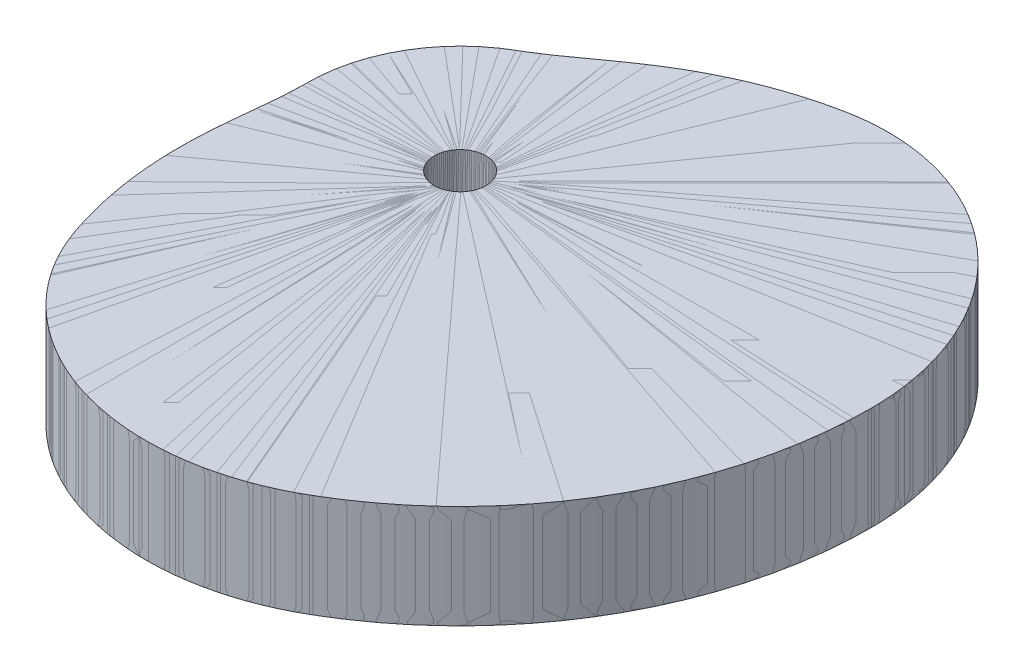
from build123d import *

# Parameters (mm, degrees)
SKETCH_1_W           = 75
SKETCH_1_H           = 20
EXTRUDE_1_DEPTH      = 10
EXTRUDE_1_DEPTH_BACK = 30
SKETCH_2_OUTSIDE_W   = 207.432
SKETCH_2_OUTSIDE_H   = 207.432
SKETCH_3_R           = 5
EXTRUDE_1_2_DEPTH    = 20


with BuildPart() as part:
    # 草图1 → 旋转1 (revolve)
    with BuildSketch(Plane.XY, mode=Mode.PRIVATE) as revolve_1_sk:
        with Locations((42.5, -10)):
            Rectangle(SKETCH_1_W, SKETCH_1_H)
    revolve(revolve_1_sk.sketch.rotate(Axis((0, -20200, 0), (0, 1, 0)), 90), axis=Axis((0, -20200, 0), (0, 1, 0)))

    # 草图2 outside → 凸台-拉伸1 (cut, two sides: drawn at the far end of the back side and taken through both)
    with BuildSketch(Plane(origin=(0, 0, 0), x_dir=(1, 0, 0), z_dir=(0, 1, 0)).offset(-EXTRUDE_1_DEPTH_BACK)):
        Rectangle(SKETCH_2_OUTSIDE_W, SKETCH_2_OUTSIDE_H)
        with BuildLine():
            ThreePointArc((79.5, 0), (79.381433397, 3.452577159), (79.027024278, 6.888962069))
            ThreePointArc((79.027024278, 6.888962069), (78.439064803, 10.286491194), (77.619168459, 13.635621004))
            ThreePointArc((77.619168459, 13.635621004), (76.57463167, 16.907988409), (75.306541664, 20.100384573))
            ThreePointArc((75.306541664, 20.100384573), (73.828400163, 23.179959664), (72.139248239, 26.149042151))
            ThreePointArc((72.139248239, 26.149042151), (70.25992434, 28.971960449), (68.186251683, 31.655355267))
            ThreePointArc((68.186251683, 31.655355267), (65.947043042, 34.162742462), (63.534209397, 36.503528587))
            ThreePointArc((63.534209397, 36.503528587), (60.984563281, 38.64264015), (58.285999266, 40.590522553))
            ThreePointArc((58.285999266, 40.590522553), (55.482647347, 42.315779013), (52.558956845, 43.828169731))
            ThreePointArc((52.558956845, 43.828169731), (49.564925997, 45.102068829), (46.48284657, 46.14505782))
            ThreePointArc((46.48284657, 46.14505782), (43.3663652, 46.93894686), (40.197595882, 47.488143497))
            ThreePointArc((40.197595882, 47.488143497), (37.030919611, 47.782838856), (33.850827709, 47.824063296))
            ThreePointArc((33.850827709, 47.824063296), (30.706387283, 47.610022696), (27.590017439, 47.139323254))
            ThreePointArc((27.590017439, 47.139323254), (24.626341718, 46.502961294), (21.691062658, 45.746345697))
            ThreePointArc((21.691062658, 45.746345697), (19.013886194, 44.941804489), (16.369597688, 44.034997636))
            ThreePointArc((16.369597688, 44.034997636), (13.971770793, 43.112041989), (11.608221997, 42.104541099))
            ThreePointArc((11.608221997, 42.104541099), (9.473436051, 41.107963918), (7.371482623, 40.04388267))
            ThreePointArc((7.371482623, 40.04388267), (5.477547324, 39.013184654), (3.612489578, 37.931108445))
            ThreePointArc((3.612489578, 37.931108445), (1.932202619, 36.899828273), (0.274753752, 35.832229889))
            ThreePointArc((0.274753752, 35.832229889), (-1.223174909, 34.82743326), (-2.705838514, 33.800245268))
            ThreePointArc((-2.705838514, 33.800245268), (-4.055816388, 32.842213366), (-5.398920019, 31.87456776))
            ThreePointArc((-5.398920019, 31.87456776), (-6.637441029, 30.976734903), (-7.877381278, 30.080863085))
            ThreePointArc((-7.877381278, 30.080863085), (-9.041881196, 29.250028327), (-10.214904591, 28.431271605))
            ThreePointArc((-10.214904591, 28.431271605), (-11.342435106, 27.668001539), (-12.483310422, 26.924826076))
            ThreePointArc((-12.483310422, 26.924826076), (-13.60906373, 26.223792048), (-14.75, 25.547749412))
            ThreePointArc((-14.75, 25.547749412), (-25.547749412, 14.75), (-29.5, 0))
            ThreePointArc((-29.5, 0), (-29.515001962, -1.326101112), (-29.559238586, -2.651549089))
            ThreePointArc((-29.559238586, -2.651549089), (-29.632409757, -4.011163827), (-29.729655768, -5.36926893))
            ThreePointArc((-29.729655768, -5.36926893), (-29.85220819, -6.79451535), (-29.989482238, -8.218419241))
            ThreePointArc((-29.989482238, -8.218419241), (-30.145359867, -9.740174904), (-30.303645424, -11.261681991))
            ThreePointArc((-30.303645424, -11.261681991), (-30.470099286, -12.908666658), (-30.624790313, -14.556797742))
            ThreePointArc((-30.624790313, -14.556797742), (-30.773029406, -16.354416086), (-30.894244483, -18.154058674))
            ThreePointArc((-30.894244483, -18.154058674), (-30.99008737, -20.12325069), (-31.043058718, -22.094061968))
            ThreePointArc((-31.043058718, -22.094061968), (-31.04763533, -24.25028746), (-30.993278347, -26.40583255))
            ThreePointArc((-30.993278347, -26.40583255), (-30.863823025, -28.75821824), (-30.659491208, -31.105285692))
            ThreePointArc((-30.659491208, -31.105285692), (-30.350238175, -33.655929437), (-29.950627764, -36.193986266))
            ThreePointArc((-29.950627764, -36.193986266), (-29.413801282, -38.937410714), (-28.771966175, -41.658184145))
            ThreePointArc((-28.771966175, -41.658184145), (-27.959574973, -44.578518177), (-27.028842736, -47.46331762))
            ThreePointArc((-27.028842736, -47.46331762), (-25.878295488, -50.397522794), (-24.491439872, -53.227708384))
            ThreePointArc((-24.491439872, -53.227708384), (-22.865692509, -55.961136537), (-21.027140706, -58.556210953))
            ThreePointArc((-21.027140706, -58.556210953), (-18.967137808, -61.025847363), (-16.721369046, -63.32785488))
            ThreePointArc((-16.721369046, -63.32785488), (-14.27707437, -65.475519464), (-11.676829966, -67.43147669))
            ThreePointArc((-11.676829966, -67.43147669), (-8.905215933, -69.207271578), (-6.009424051, -70.772417326))
            ThreePointArc((-6.009424051, -70.772417326), (-2.973226399, -72.135501115), (0.154121614, -73.274003641))
            ThreePointArc((0.154121614, -73.274003641), (3.387718686, -74.19318581), (6.678784014, -74.87870378))
            ThreePointArc((6.678784014, -74.87870378), (10.039508423, -75.332859571), (13.423889332, -75.54894266))
            ThreePointArc((13.423889332, -75.54894266), (16.839766154, -75.527249894), (20.245827165, -75.267570439))
            ThreePointArc((20.245827165, -75.267570439), (23.644568346, -74.769570516), (27.000790044, -74.037982208))
            ThreePointArc((27.000790044, -74.037982208), (30.311169712, -73.073468366), (33.547495981, -71.883891645))
            ThreePointArc((33.547495981, -71.883891645), (36.700697171, -70.47262649), (39.75, -68.849019601))
            ThreePointArc((39.75, -68.849019601), (68.849019601, -39.75), (79.5, 0))
        make_face(mode=Mode.SUBTRACT)
    extrude(amount=EXTRUDE_1_DEPTH + EXTRUDE_1_DEPTH_BACK, mode=Mode.SUBTRACT)


with BuildPart() as body_2:
    # 草图3 → Extrude 1 2 (new body)
    with BuildSketch(Plane(origin=(0, 0, 0), x_dir=(1, 0, 0), z_dir=(0, 1, 0))):
        with BuildLine():
            add(Edge.make_bspline(
                [(15.132016876, -75.567878359), (16.271104151, -75.560644505), (17.409246721, -75.513701582), (18.545060733, -75.427106667), (18.702680601, -75.415089665), (19.017804008, -75.389529847), (19.4901499, -75.346652724), (19.804715787, -75.314961987), (19.96191955, -75.298366566), (20.18327796, -75.274998575), (20.625680791, -75.225288273), (21.288357725, -75.141795255), (21.729264917, -75.080214194), (21.949501711, -75.047944039), (23.082866791, -74.88187793), (24.209815662, -74.676742374), (25.329001934, -74.43278245), (25.468716954, -74.402327407), (25.747884104, -74.340211299), (26.165856973, -74.243446536), (26.443904546, -74.176497103), (26.582782703, -74.142428734), (26.815337404, -74.085380459), (27.279630106, -73.967954673), (27.973635973, -73.78182007), (28.434376258, -73.651149037), (28.664266952, -73.584167972), (29.768161336, -73.262536763), (30.860353458, -72.903168134), (31.939553655, -72.506486426), (32.299488776, -72.374185043), (33.016325742, -72.101330034), (34.082536238, -71.667235598), (34.786149824, -71.361896313), (35.136171648, -71.2052385), (36.187649136, -70.734633089), (37.222409319, -70.228327129), (38.239240497, -69.686913502), (38.408671012, -69.596699913), (38.746503011, -69.41434011), (39.25060145, -69.13574201), (39.583765547, -68.944995107), (39.75, -68.849019601), (39.916706835, -68.752771365), (40.249421356, -68.559063932), (40.74639878, -68.264867634), (41.076264008, -68.066346971), (41.240833937, -67.966488921), (64.98761683, -53.557371348), (78.875852563, -29.502241432), (79.48112298, -1.732365402), (79.485317624, -1.539914638), (79.492308947, -1.154982639), (79.498601702, -0.577489416), (79.5, -0.192496472), (79.5, 0), (79.5, 0.191951012), (79.498609615, 0.575853035), (79.487833427, 1.15171414), (79.47684565, 1.535465135), (79.470257652, 1.727303059), (79.430720019, 2.878611504), (79.351813751, 4.027893089), (79.233631247, 5.173802011), (79.194289981, 5.555258709), (79.106914766, 6.317275591), (78.949746328, 7.457688185), (78.827627213, 8.214914712), (78.762236011, 8.592778362), (78.566172349, 9.725734003), (78.331298651, 10.851284441), (78.057892256, 11.968100624), (78.000954213, 12.200682339), (77.883748505, 12.665030646), (77.697942866, 13.359124658), (77.567490228, 13.819926827), (77.500618133, 14.049849243), (77.460683128, 14.18715544), (77.379639251, 14.461426418), (77.254453559, 14.871783922), (77.168664112, 15.14460782), (77.125181443, 15.280832097), (76.776863799, 16.372055802), (76.391041966, 17.450589932), (75.968176895, 18.515145937), (75.886005273, 18.722011673), (75.71888244, 19.134639033), (75.459851047, 19.750280601), (75.281700015, 20.158267843), (75.191258084, 20.361653844), (75.127028259, 20.506094007), (74.997190299, 20.794361425), (74.798150031, 21.224863528), (74.662723779, 21.510548313), (74.594320873, 21.653059624), (74.101407264, 22.68000087), (73.572989743, 23.68913271), (73.009710807, 24.679228154), (72.904235417, 24.864626002), (72.690862945, 25.234043963), (72.363530091, 25.784048227), (72.140579762, 26.147765965), (72.02792167, 26.328889055), (71.940808963, 26.468942222), (71.765168974, 26.748168693), (71.497277867, 27.16425951), (71.31588882, 27.439786185), (71.224487702, 27.577079116), (70.597786401, 28.518442428), (69.938269774, 29.437113873), (69.246758666, 30.331950056), (69.120319688, 30.495565897), (68.865330347, 30.821165943), (68.476502306, 31.304679779), (68.213194552, 31.623590395), (68.08051735, 31.782189634), (67.972434992, 31.911388768), (67.754912086, 32.168650833), (67.424340555, 32.550966472), (67.201290203, 32.803451471), (67.089089094, 32.929090332), (66.342367289, 33.765243185), (65.566198366, 34.574135545), (64.761576831, 35.354730979), (64.617018269, 35.494973003), (64.326096876, 35.773597247), (63.884291331, 36.185961163), (63.586297104, 36.457007592), (63.436434411, 36.591566785), (63.309710328, 36.705350208), (63.055024312, 36.931538423), (62.669060303, 37.266449564), (62.409338437, 37.486837452), (62.278865591, 37.596302044), (61.428607643, 38.309654614), (60.552938351, 38.991573787), (59.653019148, 39.641155109), (59.49369641, 39.756157738), (59.173567533, 39.984107916), (58.688912692, 40.319873186), (58.363009826, 40.539488996), (58.199357002, 40.648241434), (58.056654538, 40.743071701), (57.770182998, 40.931127177), (57.337063994, 41.208091308), (57.046267959, 41.389388599), (56.900349085, 41.479190909), (55.965468378, 42.054541071), (55.009862609, 42.594770057), (54.03485058, 43.099132314), (53.864611989, 43.187194736), (53.522992074, 43.361110499), (53.007122188, 43.615360365), (52.661103793, 43.780351665), (52.487566654, 43.861721374), (52.331804649, 43.934756512), (52.019429982, 44.079012592), (51.548133104, 44.289585255), (51.232341532, 44.426200456), (51.074040035, 44.493554517), (50.075549591, 44.918391848), (49.061645963, 45.305004522), (48.033791872, 45.652834786), (47.85694976, 45.712678921), (47.502483155, 45.830055217), (46.968424027, 45.999185351), (46.611009569, 46.107253268), (46.43195678, 46.16011679), (46.266223779, 46.209047779), (45.934165657, 46.304904205), (45.434166842, 46.442249011), (45.099787099, 46.529665044), (44.932329724, 46.572322952), (43.892978103, 46.837086242), (42.844113476, 47.061216532), (41.787323739, 47.244374506), (41.608625946, 47.275345592), (41.250822693, 47.334935598), (40.712882819, 47.417263825), (40.353634843, 47.467413883), (40.173853613, 47.491305699), (40.001309567, 47.514235737), (39.655931802, 47.557916075), (39.136923976, 47.61643836), (38.790511034, 47.650966799), (38.617198887, 47.667095472), (37.56107931, 47.765379449), (36.501878922, 47.821440482), (35.441285091, 47.835189263), (35.264578128, 47.837479966), (34.911133723, 47.839710395), (34.380863941, 47.836000919), (34.027485332, 47.828825944), (33.850827709, 47.824063296), (33.675759193, 47.819343491), (33.325684391, 47.807595653), (32.800760609, 47.782550462), (32.451142592, 47.761149306), (32.276414795, 47.749255666), (31.227681243, 47.677868859), (30.182751817, 47.563585725), (29.143380363, 47.40659808), (28.97021237, 47.380442623), (28.624233568, 47.325766886), (28.106081885, 47.237915212), (27.761960569, 47.172592184), (27.590017439, 47.139323254), (27.424673851, 47.107331255), (27.094204034, 47.042223892), (26.599148578, 46.941191901), (26.269593965, 46.871600048), (26.104936763, 46.83624477), (25.116908033, 46.624094738), (24.133408441, 46.391851415), (23.154846576, 46.139611286), (22.991767048, 46.097574903), (22.665893593, 46.012394153), (22.177937466, 45.881298059), (21.853251553, 45.791697129), (21.691062658, 45.746345697), (21.541489873, 45.704521995), (21.242606356, 45.619937422), (20.795112416, 45.490079837), (20.497348341, 45.401634911), (20.34860945, 45.356936115), (19.456107455, 45.088722703), (18.56892368, 44.803410248), (17.687385687, 44.501104092), (17.540473989, 44.450723608), (17.24697328, 44.349021676), (16.807688088, 44.19364489), (16.515514253, 44.088191584), (16.369597688, 44.034997636), (16.235485545, 43.986106995), (15.967549069, 43.887536218), (15.566544483, 43.737206814), (15.299805308, 43.635440545), (15.166587454, 43.584163211), (14.367227831, 43.276479), (13.57345672, 42.954651711), (12.785524332, 42.61878279), (12.654210891, 42.562808313), (12.391915274, 42.450082229), (11.999433876, 42.278728369), (11.738513382, 42.162855051), (11.608221997, 42.104541099), (11.488752012, 42.051070434), (11.250095999, 41.943494659), (10.892962628, 41.780226993), (10.655462637, 41.670122523), (10.536859654, 41.614755368), (9.82520413, 41.282534867), (9.118931524, 40.939019142), (8.418221098, 40.584295381), (8.301442203, 40.525177881), (8.068198355, 40.406322725), (7.71922281, 40.226274805), (7.487294823, 40.104872208), (7.371482623, 40.04388267), (7.265488773, 39.988063716), (7.053755368, 39.875942929), (6.736917348, 39.706312629), (6.526214309, 39.592267309), (6.420993224, 39.535004971), (5.789642148, 39.191417573), (5.163045776, 38.839233717), (4.54132115, 38.478519188), (4.437704411, 38.418402439), (4.230744808, 38.297696895), (3.921052972, 38.115344504), (3.715262662, 37.992656354), (3.612489578, 37.931108445), (3.51852106, 37.874833342), (3.330788128, 37.761942326), (3.049800587, 37.591583064), (2.862891475, 37.477333254), (2.769540818, 37.420039063), (2.209423061, 37.076265439), (1.653078871, 36.726417833), (1.100574112, 36.370537661), (1.008492257, 36.311225762), (0.824543663, 36.192267995), (0.549170852, 36.012972994), (0.366171075, 35.892560996), (0.274753752, 35.83222989), (0.191117906, 35.77703419), (0.023984429, 35.666433362), (-0.226301336, 35.49990369), (-0.392878811, 35.388467219), (-0.476097657, 35.33264479), (-0.975416604, 34.99770628), (-1.472205344, 34.659026249), (-1.966435843, 34.31662381), (-2.048806624, 34.259557408), (-2.213405288, 34.145218341), (-2.459983226, 33.973244899), (-2.62391169, 33.857947219), (-2.705838515, 33.800245267), (-2.781026924, 33.747289255), (-2.931340729, 33.641287762), (-3.156622436, 33.482017089), (-3.306683549, 33.375658173), (-3.381682439, 33.322434094), (-3.831676975, 33.00308877), (-4.280528659, 32.68213911), (-4.728231771, 32.359589205), (-4.871801563, 32.256153643), (-5.15870433, 32.048953815), (-5.588263308, 31.737054664), (-5.874737375, 31.529262891), (-6.018002926, 31.425406342), (-6.430843349, 31.12612866), (-6.84392044, 30.827177725), (-7.257233943, 30.528553723), (-7.326119512, 30.478783067), (-7.463903779, 30.379259921), (-7.67061956, 30.230029706), (-7.808456304, 30.130579254), (-7.877381232, 30.080863118), (-7.941836129, 30.034371253), (-8.07075739, 29.941403419), (-8.264553524, 29.802525824), (-8.393863347, 29.71009911), (-8.458558008, 29.663941466), (-8.846728102, 29.386994082), (-9.236323989, 29.112056052), (-9.627335267, 28.839134716), (-9.692503451, 28.79364808), (-9.822918161, 28.702787048), (-10.018775329, 28.566832174), (-10.14950225, 28.476420913), (-10.214904591, 28.431271605), (-10.277156176, 28.388297365), (-10.401729794, 28.302450935), (-10.589181143, 28.174537461), (-10.714338332, 28.089543881), (-10.77697953, 28.047139572), (-11.152832866, 27.792709562), (-11.530925228, 27.541618889), (-11.911226947, 27.293887255), (-11.974609531, 27.252599324), (-12.101496611, 27.170210615), (-12.292193181, 27.047188881), (-12.419564592, 26.965550936), (-12.483310422, 26.924826076), (-12.545399423, 26.885159704), (-12.669691503, 26.806005527), (-12.85676955, 26.688276782), (-12.981712021, 26.610153084), (-13.044254822, 26.571206157), (-13.419521129, 26.337518679), (-13.797340994, 26.107982652), (-14.177668494, 25.882625976), (-14.304620676, 25.807402591), (-14.559078716, 25.657890242), (-14.942662593, 25.436826959), (-15.196011631, 25.285430705), (-15.322111064, 25.208786416), (-24.115454949, 19.864118512), (-29.26055873, 10.952537353), (-29.492504966, 0.664944213), (-29.495831151, 0.517416756), (-29.500269635, 0.222311926), (-29.499924115, -0.220413097), (-29.502176588, -0.515536399), (-29.503845859, -0.663091906), (-29.508846716, -1.10514352), (-29.518720813, -1.547113136), (-29.533466952, -1.98894703), (-29.53592458, -2.062584147), (-29.541110451, -2.20984935), (-29.549527512, -2.430728064), (-29.555931, -2.577945251), (-29.559238586, -2.651549089), (-29.562634434, -2.727117028), (-29.569649262, -2.878242878), (-29.580840924, -3.104901819), (-29.588748099, -3.255983608), (-29.592813204, -3.331518501), (-29.617204233, -3.784735268), (-29.645608954, -4.237718195), (-29.678025138, -4.690431737), (-29.683427747, -4.76588276), (-29.694455753, -4.916768855), (-29.711506396, -5.143063222), (-29.723564776, -5.293870356), (-29.729655768, -5.369268929), (-29.736055045, -5.448483673), (-29.748990032, -5.606902137), (-29.768801824, -5.844496857), (-29.78228243, -6.002869825), (-29.789090921, -6.082050446), (-29.829942092, -6.557136814), (-29.873247467, -7.032005764), (-29.91900589, -7.506644619), (-29.926632252, -7.585750654), (-29.942021221, -7.74394959), (-29.965394677, -7.981220744), (-29.981446551, -8.139353735), (-29.989482238, -8.21841924), (-29.998075212, -8.302968053), (-30.015283459, -8.472063414), (-30.041162727, -8.725699658), (-30.058460168, -8.894785918), (-30.067120037, -8.979327906), (-30.119079257, -9.4865799), (-30.171439816, -9.993790623), (-30.224201679, -10.500959757), (-30.242511314, -10.676959638), (-30.279227235, -11.028949344), (-30.334560333, -11.556907907), (-30.370549265, -11.908972906), (-30.388342193, -12.085025774), (-30.443827049, -12.634022995), (-30.497351765, -13.183214786), (-30.54891566, -13.732594147), (-30.55750962, -13.824157131), (-30.574588587, -14.007293325), (-30.599880182, -14.282028342), (-30.616523266, -14.465204663), (-30.624790313, -14.556797742), (-30.633798257, -14.656599429), (-30.651684745, -14.856214484), (-30.677329145, -15.155743962), (-30.69405035, -15.35546012), (-30.702285913, -15.45532851), (-30.751699874, -16.054545897), (-30.796611014, -16.654117582), (-30.8370168, -17.254009729), (-30.843751018, -17.353990578), (-30.856969095, -17.553969139), (-30.876045139, -17.853987806), (-30.888261528, -18.054030057), (-30.894244483, -18.154058673), (-30.900784091, -18.263393951), (-30.913564052, -18.482082406), (-30.931151673, -18.810209756), (-30.942197824, -19.028992795), (-30.947522508, -19.138393971), (-30.979471398, -19.794817214), (-31.004276217, -20.451549219), (-31.02193403, -21.108512237), (-31.024876926, -21.218003372), (-31.030365609, -21.436996317), (-31.037407287, -21.765518296), (-31.041307308, -21.984545293), (-31.043058718, -22.094061968), (-31.044974229, -22.213840024), (-31.048330128, -22.453403735), (-31.051406013, -22.812780928), (-31.05246028, -23.052365974), (-31.052714542, -23.172159076), (-31.054240174, -23.890945661), (-31.045942154, -24.609685965), (-31.027822032, -25.328245735), (-31.024802129, -25.448001037), (-31.018216753, -25.687497881), (-31.006701893, -26.046702805), (-30.997934639, -26.286129706), (-30.993278347, -26.40583255), (-30.988190737, -26.536623626), (-30.977364476, -26.798180453), (-30.958802776, -27.190426101), (-30.945112436, -27.451848776), (-30.937920246, -27.582541016), (-30.894764821, -28.366735926), (-30.839121862, -29.150143807), (-30.771005493, -29.932565821), (-30.759653366, -30.062962594), (-30.736256638, -30.323695855), (-30.699083899, -30.714616259), (-30.672919246, -30.975086318), (-30.659491208, -31.105285692), (-30.644846879, -31.247278317), (-30.614735869, -31.531178753), (-30.566891966, -31.956754543), (-30.53336781, -32.240272253), (-30.516186409, -32.381980267), (-30.413091232, -33.232284192), (-30.294916284, -34.080623783), (-30.161698817, -34.926731629), (-30.139497363, -35.067740343), (-30.09425995, -35.349626378), (-30.02394674, -35.772071239), (-29.975343298, -36.053396422), (-29.950627764, -36.193986266), (-29.923736792, -36.346950692), (-29.868975116, -36.652707308), (-29.783892764, -37.110827837), (-29.725218867, -37.415857873), (-29.695393797, -37.568277377), (-29.516429611, -38.482864752), (-29.319925557, -39.393844666), (-29.105954188, -40.300880773), (-29.070295036, -40.452041829), (-28.99800855, -40.754135545), (-28.886721548, -41.206605458), (-28.810532179, -41.507738463), (-28.771966175, -41.658184145), (-28.730147219, -41.821319564), (-28.645400945, -42.147306278), (-28.514955429, -42.635436727), (-28.425787395, -42.960241793), (-28.380652206, -43.122490998), (-28.109817634, -44.096070498), (-27.819196455, -45.06392779), (-27.508909407, -46.025660786), (-27.457199375, -46.185935745), (-27.352690382, -46.506134338), (-27.192658924, -46.985380935), (-27.083808646, -47.304129873), (-27.028842736, -47.46331762), (-26.971682909, -47.628859204), (-26.856193653, -47.95953852), (-26.673199593, -48.452196877), (-26.547560769, -48.779161177), (-26.483628063, -48.942206787), (-26.099897625, -49.920822692), (-25.676405009, -50.882899687), (-25.213861021, -51.826822988), (-25.136797317, -51.984088519), (-24.980522253, -52.297567182), (-24.739750134, -52.764687108), (-24.574886658, -53.073734699), (-24.491439872, -53.227708384), (-24.407235635, -53.383079696), (-24.236760041, -53.692702037), (-23.97483765, -54.153783877), (-23.79618384, -54.458760495), (-23.705846551, -54.610647864), (-23.163642843, -55.522274673), (-22.58549237, -56.4115386), (-21.97231616, -57.277022995), (-21.871692246, -57.419051381), (-21.66858327, -57.701789569), (-21.358397571, -58.122002389), (-21.147880406, -58.399268138), (-21.041750388, -58.537230646), (-20.931168854, -58.68097985), (-20.708113641, -58.967022694), (-20.367845368, -59.391728178), (-20.137337282, -59.671799882), (-20.021166639, -59.811071168), (-19.334152311, -60.634698939), (-18.615617473, -61.430977206), (-17.866649927, -62.198700468), (-17.745978408, -62.322393855), (-17.503084032, -62.56826719), (-17.134140533, -62.932606463), (-16.885097372, -63.172249019), (-16.759855391, -63.291312514), (-16.624547845, -63.419945017), (-16.352251054, -63.675441059), (-15.938750497, -64.053384763), (-15.65986634, -64.3016737), (-15.519618743, -64.424901395), (-14.704461853, -65.141134017), (-13.862693642, -65.825893978), (-12.995528499, -66.478193402), (-12.858047423, -66.581609491), (-12.581839402, -66.786785413), (-12.163829688, -67.089654151), (-11.882712924, -67.288050508), (-11.741581636, -67.386426792), (-11.584344832, -67.496029509), (-11.268448978, -67.713194579), (-10.790327191, -68.032826072), (-10.468901765, -68.241719715), (-10.307518175, -68.345119449), (-9.383221633, -68.937323507), (-8.437566722, -69.494787886), (-7.471858513, -70.016743246), (-7.321127994, -70.098211543), (-7.018721917, -70.259399651), (-6.562304442, -70.496009646), (-6.256207852, -70.650073539), (-6.1027312, -70.726242365), (-5.926722414, -70.813593648), (-5.573578111, -70.986025905), (-5.040469437, -71.237866674), (-4.682994353, -71.401131325), (-4.503737786, -71.481607549), (-3.491224257, -71.936169779), (-2.462830284, -72.353562045), (-1.419919863, -72.733230743), (-1.259884322, -72.791491246), (-0.93916188, -72.906223036), (-0.45613832, -73.073022102), (-0.132910571, -73.180492554), (0.028990806, -73.233347118), (0.220453831, -73.295852421), (0.604184038, -73.418399777), (1.182204438, -73.594832645), (1.568960808, -73.70746584), (1.762693244, -73.762536214), (2.841019488, -74.069061187), (3.929625282, -74.336797012), (5.027115796, -74.565400639), (5.192022796, -74.599750219), (5.522206396, -74.66667499), (6.018587216, -74.761800514), (6.350144154, -74.821549844), (6.516075065, -74.850552345), (6.719764636, -74.886154553), (7.127603207, -74.954730449), (7.740752493, -75.049708492), (8.150225075, -75.107735716), (8.355140038, -75.135427162), (9.475846458, -75.286875257), (10.601197581, -75.398697689), (11.729792774, -75.47075528), (11.894392499, -75.481264504), (12.223700123, -75.500588689), (12.717990894, -75.524543785), (13.047628106, -75.537039242), (13.21247406, -75.542454475), (13.425660304, -75.5494577), (13.852124268, -75.560679479), (14.492108361, -75.569155915), (14.918719935, -75.569232916), (15.132016876, -75.567878359)],
                knots=[0, 0, 0, 0, 0.009351324, 0.009351324, 0.009351324, 0.010649557, 0.011947791, 0.013246025, 0.013246025, 0.013246025, 0.015074066, 0.016902107, 0.018730148, 0.018730148, 0.018730148, 0.028133722, 0.028133722, 0.028133722, 0.029308096, 0.030482471, 0.031656845, 0.031656845, 0.031656845, 0.033623363, 0.03558988, 0.037556398, 0.037556398, 0.037556398, 0.04699555, 0.04699555, 0.04699555, 0.050144938, 0.053294326, 0.056443714, 0.056443714, 0.056443714, 0.065900889, 0.065900889, 0.065900889, 0.067477316, 0.069053743, 0.07063017, 0.07063017, 0.07063017, 0.072211076, 0.073791982, 0.075372889, 0.075372889, 0.075372889, 0.284742328, 0.284742328, 0.284742328, 0.286323235, 0.287904141, 0.289485047, 0.289485047, 0.289485047, 0.291061474, 0.292637901, 0.294214327, 0.294214327, 0.294214327, 0.303671503, 0.303671503, 0.303671503, 0.306820891, 0.309970279, 0.313119667, 0.313119667, 0.313119667, 0.322558819, 0.322558819, 0.322558819, 0.324525336, 0.326491854, 0.328458371, 0.328458371, 0.328458371, 0.329632746, 0.330807121, 0.331981495, 0.331981495, 0.331981495, 0.341385069, 0.341385069, 0.341385069, 0.34321311, 0.345041151, 0.346869192, 0.346869192, 0.346869192, 0.348167426, 0.34946566, 0.350763893, 0.350763893, 0.350763893, 0.360115217, 0.360115217, 0.360115217, 0.361866986, 0.363618754, 0.365370523, 0.365370523, 0.365370523, 0.366725076, 0.368079628, 0.369434181, 0.369434181, 0.369434181, 0.378717959, 0.378717959, 0.378717959, 0.380416151, 0.382114343, 0.383812535, 0.383812535, 0.383812535, 0.385195927, 0.386579319, 0.387962711, 0.387962711, 0.387962711, 0.397165542, 0.397165542, 0.397165542, 0.398819632, 0.400473722, 0.402127812, 0.402127812, 0.402127812, 0.403526513, 0.404925214, 0.406323914, 0.406323914, 0.406323914, 0.415434856, 0.415434856, 0.415434856, 0.417048581, 0.418662306, 0.420276032, 0.420276032, 0.420276032, 0.421683172, 0.423090313, 0.424497454, 0.424497454, 0.424497454, 0.43350865, 0.43350865, 0.43350865, 0.435082743, 0.436656835, 0.438230928, 0.438230928, 0.438230928, 0.439643789, 0.44105665, 0.442469511, 0.442469511, 0.442469511, 0.451376879, 0.451376879, 0.451376879, 0.452910127, 0.454443375, 0.455976624, 0.455976624, 0.455976624, 0.457395813, 0.458815003, 0.460234193, 0.460234193, 0.460234193, 0.46903818, 0.46903818, 0.46903818, 0.470527642, 0.472017103, 0.473506565, 0.473506565, 0.473506565, 0.474936067, 0.476365569, 0.477795072, 0.477795072, 0.477795072, 0.486501465, 0.486501465, 0.486501465, 0.48795282, 0.489404174, 0.490855529, 0.490855529, 0.490855529, 0.492293828, 0.493732127, 0.495170426, 0.495170426, 0.495170426, 0.50379841, 0.50379841, 0.50379841, 0.505236709, 0.506675008, 0.508113307, 0.508113307, 0.508113307, 0.509496401, 0.510879495, 0.512262589, 0.512262589, 0.512262589, 0.520560723, 0.520560723, 0.520560723, 0.521943817, 0.523326911, 0.524710005, 0.524710005, 0.524710005, 0.525985514, 0.527261022, 0.52853653, 0.52853653, 0.52853653, 0.536189225, 0.536189225, 0.536189225, 0.537464733, 0.538740241, 0.540015749, 0.540015749, 0.540015749, 0.54118807, 0.542360392, 0.543532713, 0.543532713, 0.543532713, 0.550566364, 0.550566364, 0.550566364, 0.551738686, 0.552911007, 0.554083329, 0.554083329, 0.554083329, 0.555158283, 0.556233236, 0.55730819, 0.55730819, 0.55730819, 0.563757709, 0.563757709, 0.563757709, 0.564832662, 0.565907616, 0.56698257, 0.56698257, 0.56698257, 0.567966391, 0.568950212, 0.569934034, 0.569934034, 0.569934034, 0.575836823, 0.575836823, 0.575836823, 0.576820644, 0.577804465, 0.578788287, 0.578788287, 0.578788287, 0.579687824, 0.580587361, 0.581486898, 0.581486898, 0.581486898, 0.586884042, 0.586884042, 0.586884042, 0.587783579, 0.588683117, 0.589582654, 0.589582654, 0.589582654, 0.590405622, 0.59122859, 0.592051559, 0.592051559, 0.592051559, 0.596989334, 0.596989334, 0.596989334, 0.597812302, 0.59863527, 0.599458239, 0.599458239, 0.599458239, 0.600213519, 0.600968798, 0.601724078, 0.601724078, 0.601724078, 0.60625575, 0.60625575, 0.60625575, 0.607708976, 0.609162202, 0.610615429, 0.610615429, 0.610615429, 0.61480311, 0.61480311, 0.61480311, 0.615501057, 0.616199003, 0.61689695, 0.61689695, 0.61689695, 0.617549633, 0.618202315, 0.618854998, 0.618854998, 0.618854998, 0.622771079, 0.622771079, 0.622771079, 0.623423761, 0.624076444, 0.624729126, 0.624729126, 0.624729126, 0.625350366, 0.625971605, 0.626592845, 0.626592845, 0.626592845, 0.630320245, 0.630320245, 0.630320245, 0.630941484, 0.631562724, 0.632183963, 0.632183963, 0.632183963, 0.632789056, 0.633394148, 0.633999241, 0.633999241, 0.633999241, 0.637629742, 0.637629742, 0.637629742, 0.638841642, 0.640053541, 0.641265441, 0.641265441, 0.641265441, 0.718849776, 0.718849776, 0.718849776, 0.720061676, 0.721273575, 0.722485475, 0.722485475, 0.722485475, 0.726115976, 0.726115976, 0.726115976, 0.726721068, 0.727326161, 0.727931254, 0.727931254, 0.727931254, 0.728552493, 0.729173733, 0.729794972, 0.729794972, 0.729794972, 0.733522372, 0.733522372, 0.733522372, 0.734143612, 0.734764851, 0.735386091, 0.735386091, 0.735386091, 0.736038773, 0.736691455, 0.737344138, 0.737344138, 0.737344138, 0.741260219, 0.741260219, 0.741260219, 0.741912902, 0.742565584, 0.743218266, 0.743218266, 0.743218266, 0.743916213, 0.74461416, 0.745312107, 0.745312107, 0.745312107, 0.749499788, 0.749499788, 0.749499788, 0.750953014, 0.752406241, 0.753859467, 0.753859467, 0.753859467, 0.758391139, 0.758391139, 0.758391139, 0.759146419, 0.759901698, 0.760656978, 0.760656978, 0.760656978, 0.761479946, 0.762302915, 0.763125883, 0.763125883, 0.763125883, 0.768063658, 0.768063658, 0.768063658, 0.768886626, 0.769709595, 0.770532563, 0.770532563, 0.770532563, 0.7714321, 0.772331637, 0.773231175, 0.773231175, 0.773231175, 0.778628318, 0.778628318, 0.778628318, 0.779527856, 0.780427393, 0.78132693, 0.78132693, 0.78132693, 0.782310751, 0.783294573, 0.784278394, 0.784278394, 0.784278394, 0.790181183, 0.790181183, 0.790181183, 0.791165004, 0.792148826, 0.793132647, 0.793132647, 0.793132647, 0.794207601, 0.795282554, 0.796357508, 0.796357508, 0.796357508, 0.802807027, 0.802807027, 0.802807027, 0.80388198, 0.804956934, 0.806031888, 0.806031888, 0.806031888, 0.80720421, 0.808376531, 0.809548852, 0.809548852, 0.809548852, 0.816582504, 0.816582504, 0.816582504, 0.817754825, 0.818927147, 0.820099468, 0.820099468, 0.820099468, 0.821374976, 0.822650484, 0.823925992, 0.823925992, 0.823925992, 0.831578687, 0.831578687, 0.831578687, 0.832854195, 0.834129703, 0.835405211, 0.835405211, 0.835405211, 0.836788305, 0.8381714, 0.839554494, 0.839554494, 0.839554494, 0.847852627, 0.847852627, 0.847852627, 0.849235721, 0.850618816, 0.85200191, 0.85200191, 0.85200191, 0.853440209, 0.854878508, 0.856316807, 0.856316807, 0.856316807, 0.864944791, 0.864944791, 0.864944791, 0.86638309, 0.867821389, 0.869259688, 0.869259688, 0.869259688, 0.870711043, 0.872162397, 0.873613752, 0.873613752, 0.873613752, 0.882320145, 0.882320145, 0.882320145, 0.883749648, 0.88517915, 0.886608652, 0.886608652, 0.886608652, 0.888098114, 0.889587575, 0.891077036, 0.891077036, 0.891077036, 0.899881024, 0.899881024, 0.899881024, 0.901300214, 0.902719403, 0.904138593, 0.904138593, 0.904138593, 0.905671841, 0.90720509, 0.908738338, 0.908738338, 0.908738338, 0.917645706, 0.917645706, 0.917645706, 0.919058567, 0.920471428, 0.921884289, 0.921884289, 0.921884289, 0.923458382, 0.925032474, 0.926606567, 0.926606567, 0.926606567, 0.935617763, 0.935617763, 0.935617763, 0.937024904, 0.938432045, 0.939839185, 0.939839185, 0.939839185, 0.94145291, 0.943066636, 0.944680361, 0.944680361, 0.944680361, 0.953791303, 0.953791303, 0.953791303, 0.955190003, 0.956588704, 0.957987404, 0.957987404, 0.957987404, 0.959641495, 0.961295585, 0.962949675, 0.962949675, 0.962949675, 0.972152506, 0.972152506, 0.972152506, 0.973535898, 0.97491929, 0.976302682, 0.976302682, 0.976302682, 0.978000874, 0.979699066, 0.981397258, 0.981397258, 0.981397258, 0.990681036, 0.990681036, 0.990681036, 0.992035589, 0.993390141, 0.994744694, 0.994744694, 0.994744694, 0.996496463, 0.998248231, 1, 1, 1, 1], degree=3, weights=[1, 0.999594704, 0.999594704, 1, 1, 1, 1, 1, 1, 1, 1, 1, 1, 1, 0.999601759, 0.999601759, 1, 1, 1, 1, 1, 1, 1, 1, 1, 1, 1, 0.999606399, 0.999606399, 1, 1, 1, 1, 1, 1, 0.999609668, 0.999609668, 1, 1, 1, 1, 1, 1, 1, 1, 1, 1, 1, 0.917810099, 0.917810099, 1, 1, 1, 1, 1, 1, 1, 1, 1, 1, 1, 0.999609668, 0.999609668, 1, 1, 1, 1, 1, 1, 0.999606399, 0.999606399, 1, 1, 1, 1, 1, 1, 1, 1, 1, 1, 1, 0.999601759, 0.999601759, 1, 1, 1, 1, 1, 1, 1, 1, 1, 1, 1, 0.999594704, 0.999594704, 1, 1, 1, 1, 1, 1, 1, 1, 1, 1, 1, 0.999585127, 0.999585127, 1, 1, 1, 1, 1, 1, 1, 1, 1, 1, 1, 0.9995729, 0.9995729, 1, 1, 1, 1, 1, 1, 1, 1, 1, 1, 1, 0.999557888, 0.999557888, 1, 1, 1, 1, 1, 1, 1, 1, 1, 1, 1, 0.999539977, 0.999539977, 1, 1, 1, 1, 1, 1, 1, 1, 1, 1, 1, 0.999519113, 0.999519113, 1, 1, 1, 1, 1, 1, 1, 1, 1, 1, 1, 0.999495361, 0.999495361, 1, 1, 1, 1, 1, 1, 1, 1, 1, 1, 1, 0.99946898, 0.99946898, 1, 1, 1, 1, 1, 1, 1, 1, 1, 1, 1, 0.999440522, 0.999440522, 1, 1, 1, 1, 1, 1, 1, 1, 1, 1, 1, 0.999861519, 0.999861519, 1, 1, 1, 1, 1, 1, 1, 1, 1, 1, 1, 0.999876929, 0.999876929, 1, 1, 1, 1, 1, 1, 1, 1, 1, 1, 1, 0.999894927, 0.999894927, 1, 1, 1, 1, 1, 1, 1, 1, 1, 1, 1, 0.999915396, 0.999915396, 1, 1, 1, 1, 1, 1, 1, 1, 1, 1, 1, 0.999937737, 0.999937737, 1, 1, 1, 1, 1, 1, 1, 1, 1, 1, 1, 0.999960537, 0.999960537, 1, 1, 1, 1, 1, 1, 1, 1, 1, 1, 1, 0.999981189, 0.999981189, 1, 1, 1, 1, 1, 1, 1, 1, 1, 1, 1, 0.999995752, 0.999995752, 1, 1, 1, 1, 1, 1, 0.999999791, 0.999999791, 1, 1, 1, 1, 1, 1, 1, 1, 1, 1, 1, 0.999991101, 0.999991101, 1, 1, 1, 1, 1, 1, 1, 1, 1, 1, 1, 0.999973844, 0.999973844, 1, 1, 1, 1, 1, 1, 1, 1, 1, 1, 1, 0.999959483, 0.999959483, 1, 1, 1, 1, 1, 1, 0.91805041, 0.91805041, 1, 1, 1, 1, 1, 1, 0.999959483, 0.999959483, 1, 1, 1, 1, 1, 1, 1, 1, 1, 1, 1, 0.999973844, 0.999973844, 1, 1, 1, 1, 1, 1, 1, 1, 1, 1, 1, 0.999991101, 0.999991101, 1, 1, 1, 1, 1, 1, 1, 1, 1, 1, 1, 0.999999791, 0.999999791, 1, 1, 1, 1, 1, 1, 0.999995752, 0.999995752, 1, 1, 1, 1, 1, 1, 1, 1, 1, 1, 1, 0.999981189, 0.999981189, 1, 1, 1, 1, 1, 1, 1, 1, 1, 1, 1, 0.999960537, 0.999960537, 1, 1, 1, 1, 1, 1, 1, 1, 1, 1, 1, 0.999937737, 0.999937737, 1, 1, 1, 1, 1, 1, 1, 1, 1, 1, 1, 0.999915396, 0.999915396, 1, 1, 1, 1, 1, 1, 1, 1, 1, 1, 1, 0.999894927, 0.999894927, 1, 1, 1, 1, 1, 1, 1, 1, 1, 1, 1, 0.999876929, 0.999876929, 1, 1, 1, 1, 1, 1, 1, 1, 1, 1, 1, 0.999861519, 0.999861519, 1, 1, 1, 1, 1, 1, 1, 1, 1, 1, 1, 0.999440522, 0.999440522, 1, 1, 1, 1, 1, 1, 1, 1, 1, 1, 1, 0.99946898, 0.99946898, 1, 1, 1, 1, 1, 1, 1, 1, 1, 1, 1, 0.999495361, 0.999495361, 1, 1, 1, 1, 1, 1, 1, 1, 1, 1, 1, 0.999519113, 0.999519113, 1, 1, 1, 1, 1, 1, 1, 1, 1, 1, 1, 0.999539977, 0.999539977, 1, 1, 1, 1, 1, 1, 1, 1, 1, 1, 1, 0.999557888, 0.999557888, 1, 1, 1, 1, 1, 1, 1, 1, 1, 1, 1, 0.9995729, 0.9995729, 1, 1, 1, 1, 1, 1, 1, 1, 1, 1, 1, 0.999585127, 0.999585127, 1, 1, 1, 1, 1, 1, 1, 1, 1, 1, 1]))
        make_face()
        with Locations(Location((0, 0, 0), (0, 0, 270))):
            Circle(SKETCH_3_R, mode=Mode.SUBTRACT)
    extrude(amount=-EXTRUDE_1_2_DEPTH)


solid = Compound([part.part, body_2.part])
